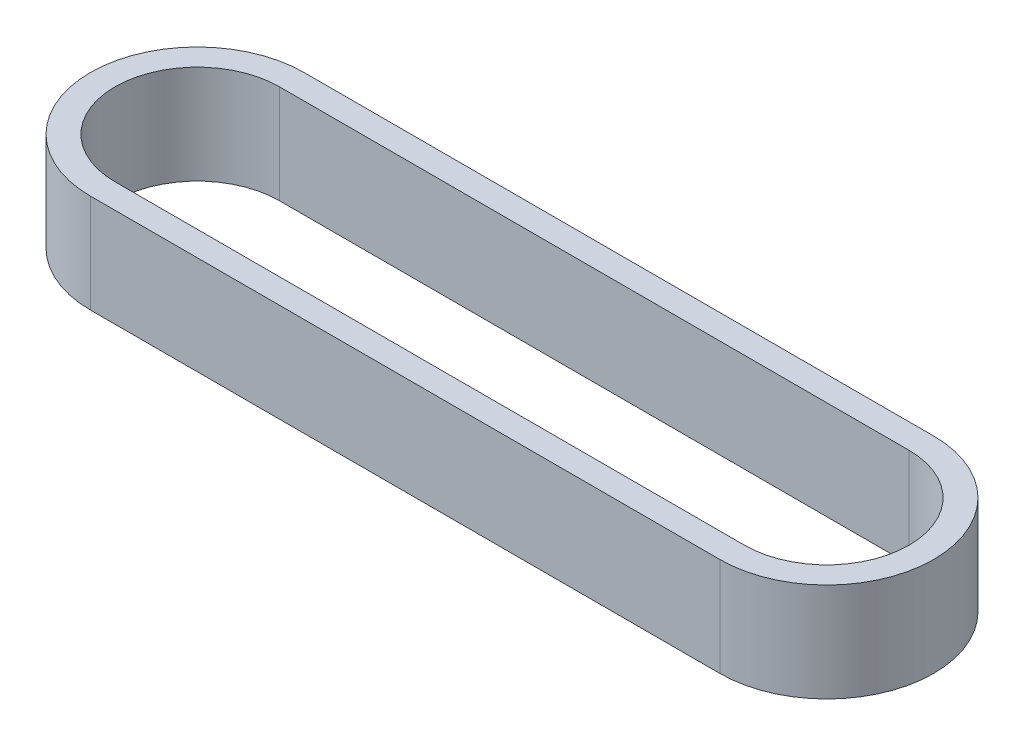
from build123d import *

# Parameters (mm, degrees)
BOSS_EXTRUDE1_DEPTH = 3


with BuildPart() as part:
    # Sketch1 → Boss-Extrude1 (new, symmetric)
    with BuildSketch(Plane(origin=(0, 0, 0), x_dir=(1, 0, 0), z_dir=(0, 1, 0))):
        with BuildLine():
            Line((0, 6.5), (38.27, 6.5))
            ThreePointArc((38.27, 6.5), (44.77, 0), (38.27, -6.5))
            Line((38.27, -6.5), (0, -6.5))
            ThreePointArc((0, -6.5), (-6.5, 0), (0, 6.5))
        make_face()
        with BuildLine():
            Line((0, 5), (38.27, 5))
            ThreePointArc((38.27, 5), (43.27, 0), (38.27, -5))
            Line((38.27, -5), (0, -5))
            ThreePointArc((0, -5), (-5, 0), (0, 5))
        make_face(mode=Mode.SUBTRACT)
    extrude(amount=BOSS_EXTRUDE1_DEPTH, both=True)


solid = part.part
